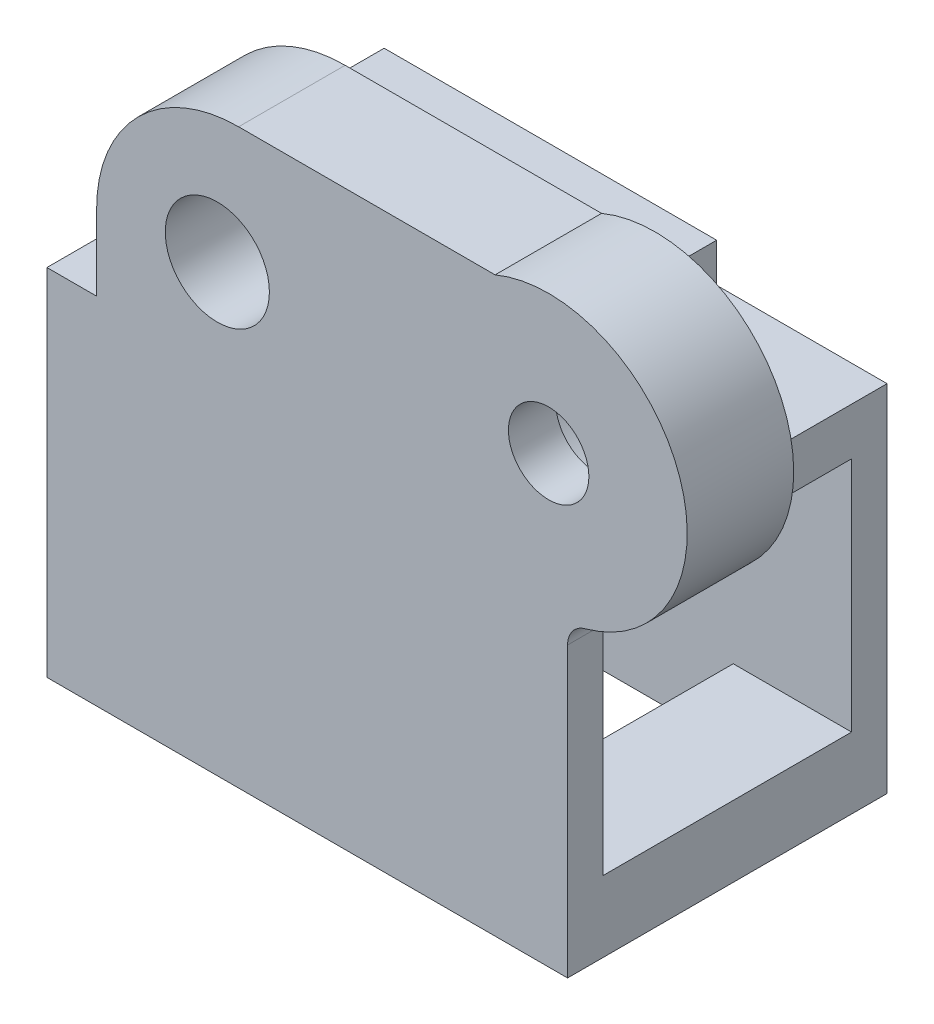
from build123d import *

# Parameters (mm, degrees)
SKETCH1_W            = 21.5
SKETCH1_H            = 10.5
BOSS_EXTRUDE1_DEPTH  = 2
BOSS_EXTRUDE3_DEPTH  = 15
BOSS_EXTRUDE7_REACH  = 30.623
SKETCH8_W            = 1
SKETCH8_H            = 2
BOSS_EXTRUDE5_DEPTH  = 3
SKETCH6_R            = 1.7
BOSS_EXTRUDE6_DEPTH  = 2
BOSS_EXTRUDE8_DEPTH  = 2.5
FILLET1_R            = 1
SKETCH12_W           = 1
SKETCH12_H           = 10.5
CUT_EXTRUDE1_DEPTH   = 13
CUT_EXTRUDE2_DEPTH   = 1.5
SKETCH15_R           = 2.2
BOSS_EXTRUDE9_DEPTH  = 3
SKETCH16_R           = 0.670189152
BOSS_EXTRUDE10_DEPTH = 4.5
SKETCH17_R           = 2.2
CUT_EXTRUDE3_DEPTH   = 4.5
CUT_EXTRUDE4_START   = -4.5
SKETCH18_R           = 2.2
CUT_EXTRUDE4_DEPTH   = 4.5
FILLET2_R            = 6


with BuildPart() as part:
    # Sketch1 → Boss-Extrude1 (new body)
    with BuildSketch(Plane(origin=(0, 0, 0), x_dir=(1, 0, 0), z_dir=(0, 1, 0))):
        with Locations((10.75, 5.25)):
            Rectangle(SKETCH1_W, SKETCH1_H)
    extrude(amount=BOSS_EXTRUDE1_DEPTH)

    # Sketch3 → Boss-Extrude3 (add)
    with BuildSketch(Plane(origin=(0, 2, 0), x_dir=(1, 0, 0), z_dir=(0, 1, 0))):
        Polygon((0, 10.5), (22.5, 10.5), (22.5, 12), (-1, 12), (-1, -1.5), (22.5, -1.5), (22.5, 0), (0, 0), align=None)
    extrude(amount=-BOSS_EXTRUDE3_DEPTH)

    # Sketch8 → Boss-Extrude7 (add, up to next)
    with BuildSketch(Plane(origin=(0, 0, 0), x_dir=(-1, 0, 0), z_dir=(0, 0, -1)), mode=Mode.PRIVATE) as boss_extrude7_sk1:
        with Locations((-22, 1)):
            Rectangle(SKETCH8_W, SKETCH8_H)
    boss_extrude7_tool1 = extrude(boss_extrude7_sk1.sketch, amount=BOSS_EXTRUDE7_REACH, mode=Mode.PRIVATE) - part.part
    add(boss_extrude7_tool1.solids().sort_by_distance((22, 1, 0))[0])

    # Sketch5 → Boss-Extrude5 (add)
    with BuildSketch(Plane.XZ.offset(13)):
        Polygon((17.5, 0), (17.5, -10.5), (22.5, -10.5), (22.5, 1.5), (17.5, 1.5), align=None)
    extrude(amount=-BOSS_EXTRUDE5_DEPTH)



with BuildPart() as body_2:
    # Sketch6 → Boss-Extrude6 (new body)
    with BuildSketch(Plane.XY.offset(1.5)):
        with BuildLine():
            Line((22.5, 0), (22.5, 2))
            Line((22.5, 2), (17.24578851, 2))
            ThreePointArc((17.24578851, 2), (23.78286231, 11.271899542), (22.5, 0))
        make_face()
        with Locations((21.7, 5.8)):
            Circle(SKETCH6_R, mode=Mode.SUBTRACT)
    extrude(amount=-BOSS_EXTRUDE6_DEPTH)


with BuildPart() as part_1:
    add(part.part)

    add(body_2.part)  # Boss-Extrude8 merges body 2
    # Sketch9 → Boss-Extrude8 (add)
    with BuildSketch(Plane(origin=(0, 0, -0.5), x_dir=(-1, 0, 0), z_dir=(0, 0, -1))):
        with BuildLine():
            Line((-22.5, 2), (-22.577496439, 2))
            ThreePointArc((-22.577496439, 2), (-21.7, 9.7), (-20.822503561, 2))
            Line((-20.822503561, 2), (-17.24578851, 2))
            ThreePointArc((-17.24578851, 2), (-23.78286231, 11.271899542), (-22.5, 0))
            Line((-22.5, 0), (-22.5, 2))
        make_face()
    extrude(amount=BOSS_EXTRUDE8_DEPTH)

    # Fillet1
    fillet1_edges = [part_1.edges().sort_by_distance(p)[0] for p in [
        (22.5, 0, 0.75),
        (17.24578851, 2, -0.75),
    ]]
    fillet(fillet1_edges, radius=FILLET1_R)

    # Sketch12 → Cut-Extrude1 (cut)
    with BuildSketch(Plane.XZ.offset(13)):
        with Locations((-0.5, -5.25)):
            Rectangle(SKETCH12_W, SKETCH12_H)
    extrude(amount=-CUT_EXTRUDE1_DEPTH, mode=Mode.SUBTRACT)

    # Sketch13 → Cut-Extrude2 (cut)
    with BuildSketch(Plane.ZY.offset(1)):
        Polygon((-12, -13), (-12, 2), (1.5, 2), (1.5, -13), (0, -13), (0, 0), (-10.5, 0), (-10.5, -13), align=None)
    extrude(amount=-CUT_EXTRUDE2_DEPTH, mode=Mode.SUBTRACT)

    # Sketch15 → Boss-Extrude9 (add)
    with BuildSketch(Plane(origin=(0, 2, 0), x_dir=(1, 0, 0), z_dir=(0, 1, 0))):
        Polygon((5.85, 10.65), (16.65, 10.65), (16.65, -0.15), (16.65, -1.5), (2.6, -1.5), (2.6, 10.65), align=None)
        with Locations(Location((11.25, 5.25, 0), (0, 0, 270))):
            Circle(SKETCH15_R, mode=Mode.SUBTRACT)
    extrude(amount=BOSS_EXTRUDE9_DEPTH)

    # Sketch16 → Boss-Extrude10 (add)
    with BuildSketch(Plane.XY.offset(1.5)):
        with BuildLine():
            Line((2.6, 5), (2.6, 11.2))
            Line((2.6, 11.2), (19.4372583, 11.2))
            ThreePointArc((19.4372583, 11.2), (16.614535328, 8.701387439), (15.9, 5))
            Line((15.9, 5), (2.6, 5))
        make_face()
        with Locations((7.7, 5.8)):
            Circle(SKETCH16_R, mode=Mode.SUBTRACT)
    extrude(amount=-BOSS_EXTRUDE10_DEPTH)

    # Sketch17 → Cut-Extrude3 (cut)
    with BuildSketch(Plane.XY.offset(1.5)):
        with Locations((7.7, 5.8)):
            Circle(SKETCH17_R)
    extrude(amount=-CUT_EXTRUDE3_DEPTH, mode=Mode.SUBTRACT)

    # Sketch18 → Cut-Extrude4 (cut)
    with BuildSketch(Plane(origin=(0, 2, 0), x_dir=(1, 0, 0), z_dir=(0, 1, 0)).offset(CUT_EXTRUDE4_START)):
        with Locations(Location((11.25, 5.25, 0), (0, 0, 90))):
            Circle(SKETCH18_R)
    extrude(amount=CUT_EXTRUDE4_DEPTH, mode=Mode.SUBTRACT)

    # Fillet2
    fillet2_edges = [part_1.edges().sort_by_distance(p)[0] for p in [
        (2.6, 11.2, -0.75),
    ]]
    fillet(fillet2_edges, radius=FILLET2_R)


solid = part_1.part
